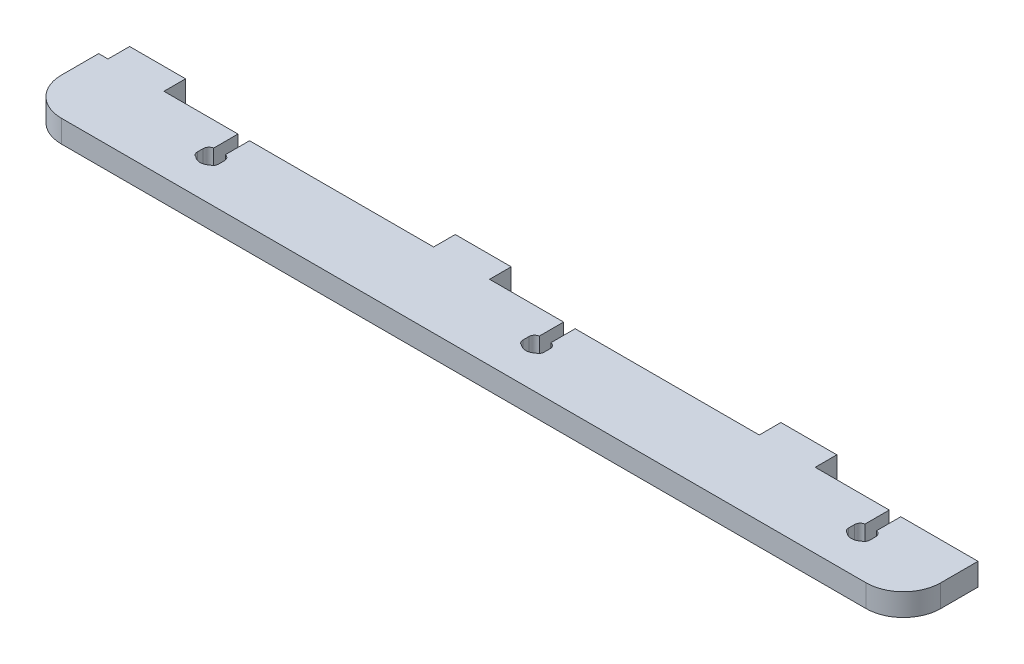
from build123d import *

# Parameters (mm, degrees)
SALIENTE_EXTRUIR1_DEPTH = 6


with BuildPart() as part:
    # Croquis1 → Saliente-Extruir1 (new body)
    with BuildSketch(Plane(origin=(0, 0, 0), x_dir=(1, 0, 0), z_dir=(0, 1, 0))):
        with BuildLine():
            Line((193.24437935, 2.559419019), (193.24437935, 12.559419019))
            Line((193.24437935, 12.559419019), (172.55, 12.559419019))
            Line((172.55, 12.559419019), (172.55, 6.059193777))
            ThreePointArc((172.55, 6.059193777), (173.474604635, 5.531104241), (173.840337631, 4.531098409))
            Line((173.840337631, 4.531098409), (173.840337631, 2.981098409))
            ThreePointArc((173.840337631, 2.981098409), (173.651640801, 2.239914437), (173.131494174, 1.679193777))
            Line((173.131494174, 1.679193777), (172.962249241, 1.679193777))
            ThreePointArc((172.962249241, 1.679193777), (171, 0.866183792), (169.037750759, 1.679193777))
            Line((169.037750759, 1.679193777), (168.868505826, 1.679193777))
            ThreePointArc((168.868505826, 1.679193777), (168.348359199, 2.239914437), (168.159662369, 2.981098409))
            Line((168.159662369, 2.981098409), (168.159662369, 4.531098409))
            ThreePointArc((168.159662369, 4.531098409), (168.525395365, 5.531104241), (169.45, 6.059193777))
            Line((169.45, 6.059193777), (169.45, 12.559419019))
            Line((169.45, 12.559419019), (152.1, 12.559419019))
            Line((152.1, 12.559419019), (149.6, 12.559419019))
            Line((149.6, 12.559419019), (149.6, 18.359419019))
            Line((149.6, 18.359419019), (134.6, 18.359419019))
            Line((134.6, 18.359419019), (134.6, 12.559419019))
            Line((134.6, 12.559419019), (132.1, 12.559419019))
            Line((132.1, 12.559419019), (85.25, 12.559419019))
            Line((85.25, 12.559419019), (85.25, 6.059193777))
            ThreePointArc((85.25, 6.059193777), (86.174604635, 5.531104241), (86.540337631, 4.531098409))
            Line((86.540337631, 4.531098409), (86.540337631, 2.981098409))
            ThreePointArc((86.540337631, 2.981098409), (86.351640801, 2.239914437), (85.831494174, 1.679193777))
            Line((85.831494174, 1.679193777), (85.662249241, 1.679193777))
            ThreePointArc((85.662249241, 1.679193777), (83.7, 0.866183792), (81.737750759, 1.679193777))
            Line((81.737750759, 1.679193777), (81.568505826, 1.679193777))
            ThreePointArc((81.568505826, 1.679193777), (81.048359199, 2.239914437), (80.859662369, 2.981098409))
            Line((80.859662369, 2.981098409), (80.859662369, 4.531098409))
            ThreePointArc((80.859662369, 4.531098409), (81.225395365, 5.531104241), (82.15, 6.059193777))
            Line((82.15, 6.059193777), (82.15, 12.559419019))
            Line((82.15, 12.559419019), (64.8, 12.559419019))
            Line((64.8, 12.559419019), (62.3, 12.559419019))
            Line((62.3, 12.559419019), (62.3, 18.359419019))
            Line((62.3, 18.359419019), (47.3, 18.359419019))
            Line((47.3, 18.359419019), (47.3, 12.559419019))
            Line((47.3, 12.559419019), (44.8, 12.559419019))
            Line((44.8, 12.559419019), (-2.05, 12.559419019))
            Line((-2.05, 12.559419019), (-2.05, 6.059193777))
            ThreePointArc((-2.05, 6.059193777), (-1.125395365, 5.531104241), (-0.759662369, 4.531098409))
            Line((-0.759662369, 4.531098409), (-0.759662369, 2.981098409))
            ThreePointArc((-0.759662369, 2.981098409), (-0.948359199, 2.239914437), (-1.468505826, 1.679193777))
            Line((-1.468505826, 1.679193777), (-1.637750759, 1.679193777))
            ThreePointArc((-1.637750759, 1.679193777), (-3.6, 0.866183792), (-5.562249241, 1.679193777))
            Line((-5.562249241, 1.679193777), (-5.731494174, 1.679193777))
            ThreePointArc((-5.731494174, 1.679193777), (-6.251640801, 2.239914437), (-6.440337631, 2.981098409))
            Line((-6.440337631, 2.981098409), (-6.440337631, 4.531098409))
            ThreePointArc((-6.440337631, 4.531098409), (-6.074604635, 5.531104241), (-5.15, 6.059193777))
            Line((-5.15, 6.059193777), (-5.15, 12.559419019))
            Line((-5.15, 12.559419019), (-22.5, 12.559419019))
            Line((-22.5, 12.559419019), (-25, 12.559419019))
            Line((-25, 12.559419019), (-25, 18.359419019))
            Line((-25, 18.359419019), (-40, 18.359419019))
            Line((-40, 18.359419019), (-40, 12.559419019))
            Line((-40, 12.559419019), (-42.5, 12.559419019))
            Line((-42.5, 12.559419019), (-42.5, 2.559419019))
            ThreePointArc((-42.5, 2.559419019), (-39.571067812, -4.511648793), (-32.5, -7.440580981))
            Line((-32.5, -7.440580981), (183.24437935, -7.440580981))
            ThreePointArc((183.24437935, -7.440580981), (190.315447162, -4.511648793), (193.24437935, 2.559419019))
        make_face()
    extrude(amount=SALIENTE_EXTRUIR1_DEPTH)


solid = part.part
